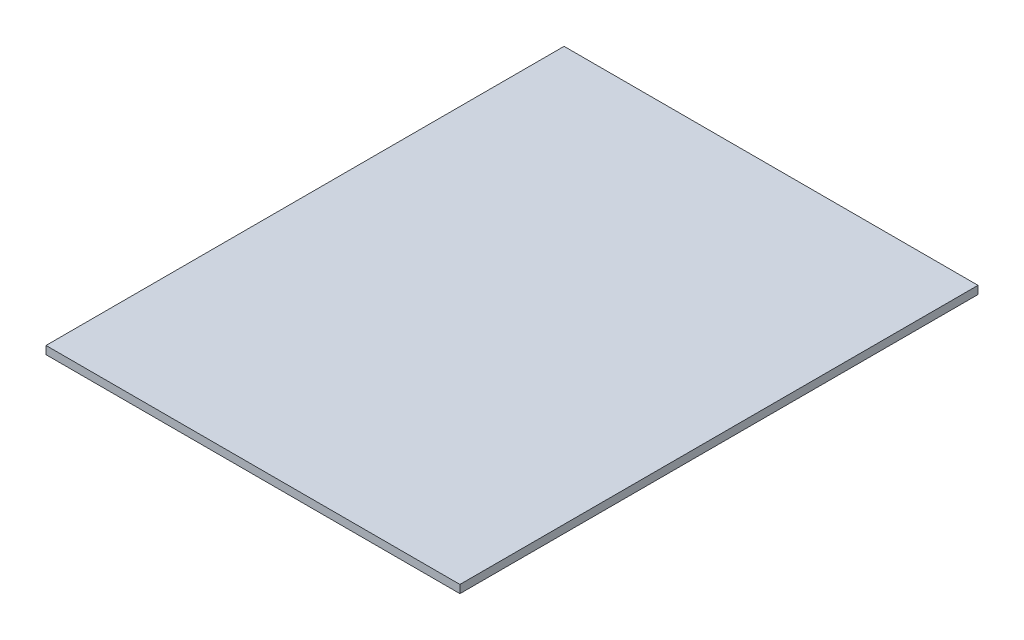
from build123d import *

# Parameters (mm, degrees)
CROQUIS1_W              = 310
CROQUIS1_H              = 388
SALIENTE_EXTRUIR1_DEPTH = 6


with BuildPart() as part:
    # Croquis1 → Saliente-Extruir1 (new body)
    with BuildSketch(Plane(origin=(0, 0, 0), x_dir=(1, 0, 0), z_dir=(0, 1, 0))):
        with Locations((36.565336513, -81.686230248)):
            Rectangle(CROQUIS1_W, CROQUIS1_H)
    extrude(amount=SALIENTE_EXTRUIR1_DEPTH)


solid = part.part
